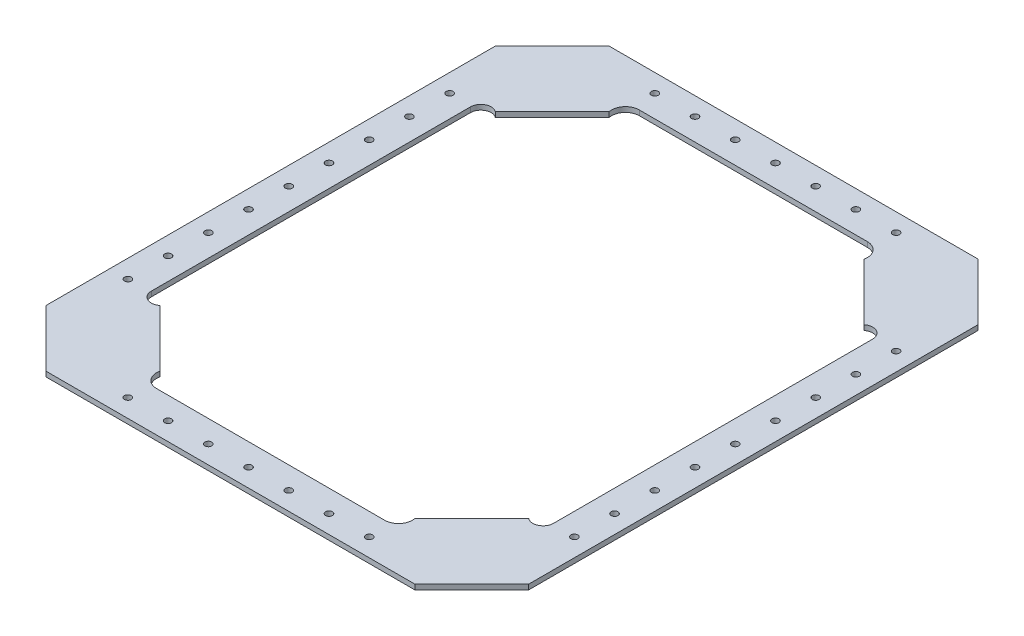
from build123d import *

# Parameters (mm, degrees)
BOSS_EXTRUDE1_DEPTH = 3.175
CUT_EXTRUDE1_DEPTH  = 252.960239461
BOSS_EXTRUDE2_DEPTH = 3.175
SKETCH4_R           = 2.159
CUT_EXTRUDE2_DEPTH  = 252.960239461
SKETCH6_W           = 254
SKETCH6_H           = 106.880400145
CUT_EXTRUDE3_DEPTH  = 252.960239461


with BuildPart() as part:
    # Sketch1 → Boss-Extrude1 (new body)
    with BuildSketch(Plane(origin=(0, 0, 0), x_dir=(1, 0, 0), z_dir=(0, 1, 0))):
        Polygon((-152.4, 119.059630377), (-116.478975516, 154.980654861), (116.478975516, 154.980654861), (152.4, 119.059630377), (152.4, -164.698320655), (116.478975516, -200.619345139), (-116.478975516, -200.619345139), (-152.4, -164.698320655), align=None)
    extrude(amount=BOSS_EXTRUDE1_DEPTH)

    # Sketch2 → Cut-Extrude1 (cut, through all)
    with BuildSketch(Plane(origin=(0, 3.175, 0), x_dir=(1, 0, 0), z_dir=(0, 1, 0))):
        Polygon((-91.078975516, 129.580654861), (91.078975516, 129.580654861), (127, 93.659630377), (127, 8.930654861), (82.442975516, 8.930654861), (-74.314975516, 8.930654861), (-127, 8.930654861), (-127, 93.659630377), align=None)
        Polygon((127, -139.298320655), (91.078975516, -175.219345139), (-91.078975516, -175.219345139), (-127, -139.298320655), (-127, -54.569345139), (-74.314975516, -54.569345139), (82.442975516, -54.569345139), (127, -54.569345139), align=None)
    extrude(amount=-CUT_EXTRUDE1_DEPTH, mode=Mode.SUBTRACT)

    # Sketch5 → Boss-Extrude2 (add)
    with BuildSketch(Plane(origin=(0, 3.175, 0), x_dir=(1, 0, 0), z_dir=(0, 1, 0))):
        with BuildLine():
            Line((-116.478975516, 83.138605892), (-80.557951031, 119.059630377))
            ThreePointArc((-80.557951031, 119.059630377), (-78.800891411, 126.352814743), (-72.028975516, 129.580654861))
            Line((-72.028975516, 129.580654861), (-59.328975516, 129.580654861))
            Line((-59.328975516, 129.580654861), (-59.328975516, 154.980654861))
            Line((-59.328975516, 154.980654861), (-116.478975516, 154.980654861))
            Line((-116.478975516, 154.980654861), (-152.4, 119.059630377))
            Line((-152.4, 119.059630377), (-152.4, 65.258187686))
            Line((-152.4, 65.258187686), (-127, 65.258187686))
            Line((-127, 65.258187686), (-127, 77.958187686))
            ThreePointArc((-127, 77.958187686), (-123.351279088, 83.821819005), (-116.478975516, 83.138605892))
        make_face()
        with BuildLine():
            Line((127, 65.258187686), (127, 77.958187686))
            ThreePointArc((127, 77.958187686), (123.351279088, 83.821819005), (116.478975516, 83.138605892))
            Line((116.478975516, 83.138605892), (80.557951031, 119.059630377))
            ThreePointArc((80.557951031, 119.059630377), (78.800891411, 126.352814743), (72.028975516, 129.580654861))
            Line((72.028975516, 129.580654861), (59.328975516, 129.580654861))
            Line((59.328975516, 129.580654861), (59.328975516, 154.980654861))
            Line((59.328975516, 154.980654861), (116.478975516, 154.980654861))
            Line((116.478975516, 154.980654861), (152.4, 119.059630377))
            Line((152.4, 119.059630377), (152.4, 65.258187686))
            Line((152.4, 65.258187686), (127, 65.258187686))
        make_face()
        with BuildLine():
            Line((116.478975516, -128.777296171), (80.557951031, -164.698320655))
            ThreePointArc((80.557951031, -164.698320655), (78.800891411, -171.991505021), (72.028975516, -175.219345139))
            Line((72.028975516, -175.219345139), (59.328975516, -175.219345139))
            Line((59.328975516, -175.219345139), (59.328975516, -200.619345139))
            Line((59.328975516, -200.619345139), (116.478975516, -200.619345139))
            Line((116.478975516, -200.619345139), (152.4, -164.698320655))
            Line((152.4, -164.698320655), (152.4, -110.896877964))
            Line((152.4, -110.896877964), (127, -110.896877964))
            Line((127, -110.896877964), (127, -123.596877964))
            ThreePointArc((127, -123.596877964), (123.351279088, -129.460509283), (116.478975516, -128.777296171))
        make_face()
        with BuildLine():
            Line((-127, -110.896877964), (-127, -123.596877964))
            ThreePointArc((-127, -123.596877964), (-123.351279088, -129.460509283), (-116.478975516, -128.777296171))
            Line((-116.478975516, -128.777296171), (-80.557951031, -164.698320655))
            ThreePointArc((-80.557951031, -164.698320655), (-78.800891411, -171.991505021), (-72.028975516, -175.219345139))
            Line((-72.028975516, -175.219345139), (-59.328975516, -175.219345139))
            Line((-59.328975516, -175.219345139), (-59.328975516, -200.619345139))
            Line((-59.328975516, -200.619345139), (-116.478975516, -200.619345139))
            Line((-116.478975516, -200.619345139), (-152.4, -164.698320655))
            Line((-152.4, -164.698320655), (-152.4, -110.896877964))
            Line((-152.4, -110.896877964), (-127, -110.896877964))
        make_face()
    extrude(amount=-BOSS_EXTRUDE2_DEPTH)

    # Sketch4 → Cut-Extrude2 (cut, through all)
    with BuildSketch(Plane(origin=(0, 3.175, 0), x_dir=(1, 0, 0), z_dir=(0, 1, 0))):
        with Locations(Location((0, 143.550654861, 0), (0, 0, 270))):
            Circle(SKETCH4_R)
        with Locations(Location((-50.8, 143.550654861, 0), (0, 0, 270))):
            Circle(SKETCH4_R)
        with Locations(Location((50.8, 143.550654861, 0), (0, 0, 270))):
            Circle(SKETCH4_R)
        with Locations(Location((-25.4, 143.550654861, 0), (0, 0, 270))):
            Circle(SKETCH4_R)
        with Locations(Location((25.4, 143.550654861, 0), (0, 0, 270))):
            Circle(SKETCH4_R)
        with Locations(Location((-140.97, -22.819345139, 0), (0, 0, 270))):
            Circle(SKETCH4_R)
        with Locations(Location((-140.97, 2.580654861, 0), (0, 0, 270))):
            Circle(SKETCH4_R)
        with Locations(Location((-140.97, 27.980654861, 0), (0, 0, 270))):
            Circle(SKETCH4_R)
        with Locations(Location((140.97, -22.819345139, 0), (0, 0, 270))):
            Circle(SKETCH4_R)
        with Locations(Location((140.97, 2.580654861, 0), (0, 0, 270))):
            Circle(SKETCH4_R)
        with Locations(Location((140.97, 27.980654861, 0), (0, 0, 270))):
            Circle(SKETCH4_R)
        with Locations(Location((140.97, -73.619345139, 0), (0, 0, 90))):
            Circle(SKETCH4_R)
        with Locations(Location((140.97, -48.219345139, 0), (0, 0, 90))):
            Circle(SKETCH4_R)
        with Locations(Location((-140.97, -73.619345139, 0), (0, 0, 90))):
            Circle(SKETCH4_R)
        with Locations(Location((-140.97, -48.219345139, 0), (0, 0, 90))):
            Circle(SKETCH4_R)
        with Locations(Location((25.4, -189.189345139, 0), (0, 0, 90))):
            Circle(SKETCH4_R)
        with Locations(Location((-25.4, -189.189345139, 0), (0, 0, 90))):
            Circle(SKETCH4_R)
        with Locations(Location((50.8, -189.189345139, 0), (0, 0, 90))):
            Circle(SKETCH4_R)
        with Locations(Location((-50.8, -189.189345139, 0), (0, 0, 90))):
            Circle(SKETCH4_R)
        with Locations(Location((0, -189.189345139, 0), (0, 0, 90))):
            Circle(SKETCH4_R)
        with Locations(Location((-76.2, 143.550654861, 0), (0, 0, 270))):
            Circle(SKETCH4_R)
        with Locations(Location((76.2, 143.550654861, 0), (0, 0, 270))):
            Circle(SKETCH4_R)
        with Locations(Location((-140.97, 53.380654861, 0), (0, 0, 270))):
            Circle(SKETCH4_R)
        with Locations(Location((140.97, 53.380654861, 0), (0, 0, 270))):
            Circle(SKETCH4_R)
        with Locations(Location((140.97, -99.019345139, 0), (0, 0, 90))):
            Circle(SKETCH4_R)
        with Locations(Location((76.2, -189.189345139, 0), (0, 0, 90))):
            Circle(SKETCH4_R)
        with Locations(Location((-76.2, -189.189345139, 0), (0, 0, 90))):
            Circle(SKETCH4_R)
        with Locations(Location((-140.97, -99.019345139, 0), (0, 0, 90))):
            Circle(SKETCH4_R)
        with Locations(Location((-140.97, -124.419345139, 0), (0, 0, 270))):
            Circle(SKETCH4_R)
        with Locations(Location((-140.97, 78.780654861, 0), (0, 0, 90))):
            Circle(SKETCH4_R)
        with Locations(Location((140.97, 78.780654861, 0), (0, 0, 270))):
            Circle(SKETCH4_R)
        with Locations(Location((140.97, -124.419345139, 0), (0, 0, 90))):
            Circle(SKETCH4_R)
    extrude(amount=-CUT_EXTRUDE2_DEPTH, mode=Mode.SUBTRACT)

    # Sketch6 → Cut-Extrude3 (cut, through all)
    with BuildSketch(Plane(origin=(0, 3.175, 0), x_dir=(1, 0, 0), z_dir=(0, 1, 0))):
        with Locations((0, -26.175268273)):
            Rectangle(SKETCH6_W, SKETCH6_H)
    extrude(amount=-CUT_EXTRUDE3_DEPTH, mode=Mode.SUBTRACT)


solid = part.part
